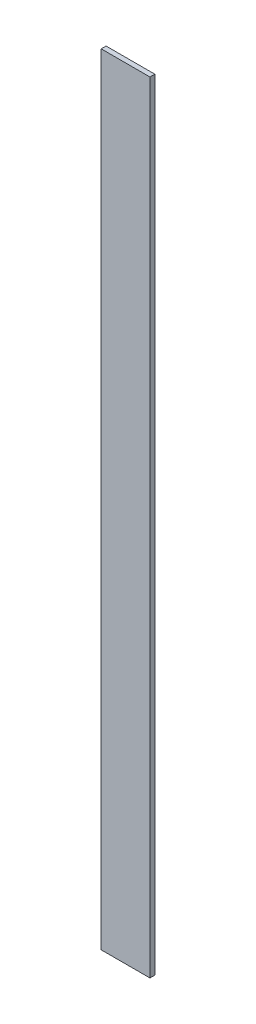
from build123d import *

# Parameters (mm, degrees)
SKETCH1_W           = 12.7
SKETCH1_H           = 1.27
BOSS_EXTRUDE1_DEPTH = 203.2


with BuildPart() as part:
    # Sketch1 → Boss-Extrude1 (new body)
    with BuildSketch(Plane(origin=(0, 0, 0), x_dir=(1, 0, 0), z_dir=(0, 1, 0))):
        Rectangle(SKETCH1_W, SKETCH1_H)
    extrude(amount=BOSS_EXTRUDE1_DEPTH)


solid = part.part
